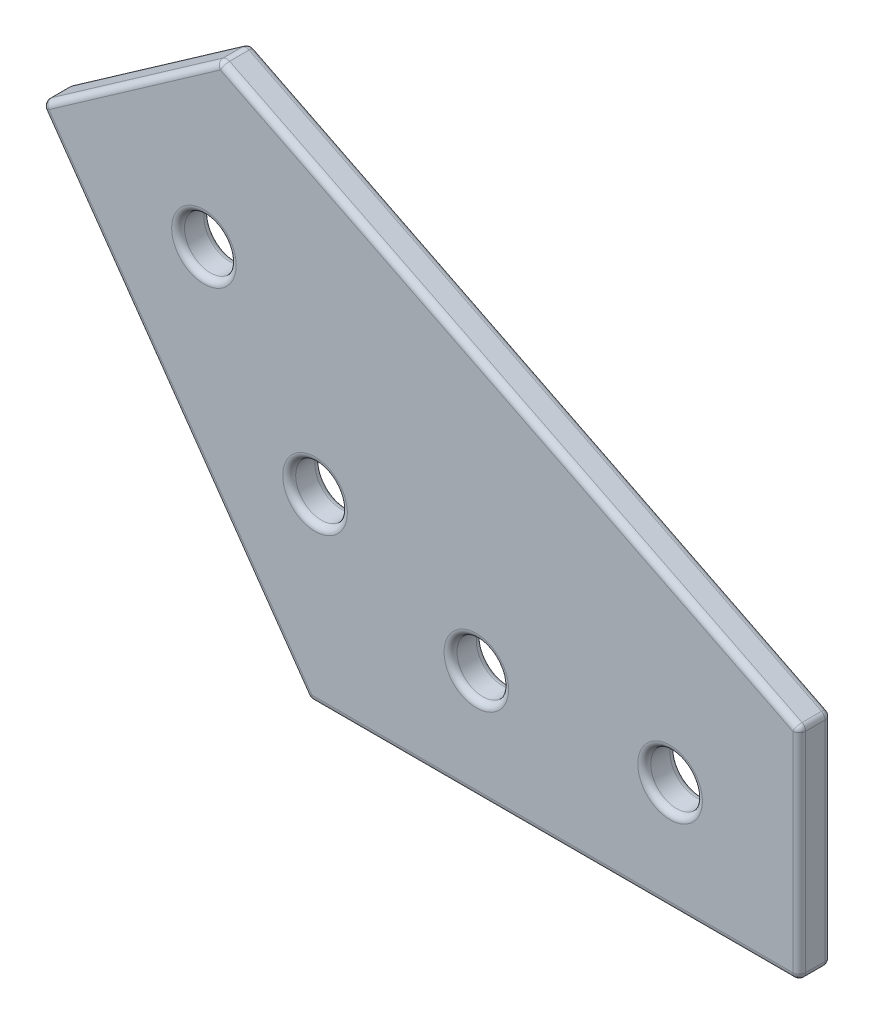
from build123d import *

# Parameters (mm, degrees)
BOSS_EXTRUDE1_DEPTH = 5
SKETCH2_R           = 4
CUT_EXTRUDE1_DEPTH  = 80.801735059
FILLET1_R           = 1


with BuildPart() as part:
    # Sketch1 → Boss-Extrude1 (new body)
    with BuildSketch(Plane.XY):
        Polygon((-66.46031978, 24.388523211), (-38.609150274, 43.890122047), (51.123971856, -1), (51.123971856, -35), (-24.876028144, -35), align=None)
    extrude(amount=BOSS_EXTRUDE1_DEPTH)

    # Sketch2 → Cut-Extrude1 (cut, through all)
    with BuildSketch(Plane.XY.offset(5)):
        with Locations((31.123971856, -18)):
            Circle(SKETCH2_R)
        with Locations((1.123971856, -18)):
            Circle(SKETCH2_R)
        with Locations((-41.0632063, 17.756281743)):
            Circle(SKETCH2_R)
        with Locations((-23.855913209, -6.818279586)):
            Circle(SKETCH2_R)
    extrude(amount=-CUT_EXTRUDE1_DEPTH, mode=Mode.SUBTRACT)

    # Fillet1
    fillet1_edges = [part.edges().sort_by_distance(p)[0] for p in [
        (51.123971856, -18, 5),
        (6.257410791, 21.445061023, 5),
        (-52.534735027, 34.139322629, 5),
        (27.123971856, -18, 0),
        (27.123971856, -18, 5),
        (-2.876028144, -18, 0),
        (-2.876028144, -18, 5),
        (-27.855913209, -6.818279586, 0),
        (-27.855913209, -6.818279586, 5),
        (-45.0632063, 17.756281743, 0),
        (-45.0632063, 17.756281743, 5),
        (-45.668173962, -5.305738395, 5),
        (-52.534735027, 34.139322629, 0),
        (6.257410791, 21.445061023, 0),
        (51.123971856, -18, 0),
        (13.123971856, -35, 0),
        (-45.668173962, -5.305738395, 0),
        (13.123971856, -35, 5),
        (-66.46031978, 24.388523211, 2.5),
        (-38.609150274, 43.890122047, 2.5),
        (51.123971856, -1, 2.5),
        (51.123971856, -35, 2.5),
        (-24.876028144, -35, 2.5),
    ]]
    fillet(fillet1_edges, radius=FILLET1_R)


solid = part.part
